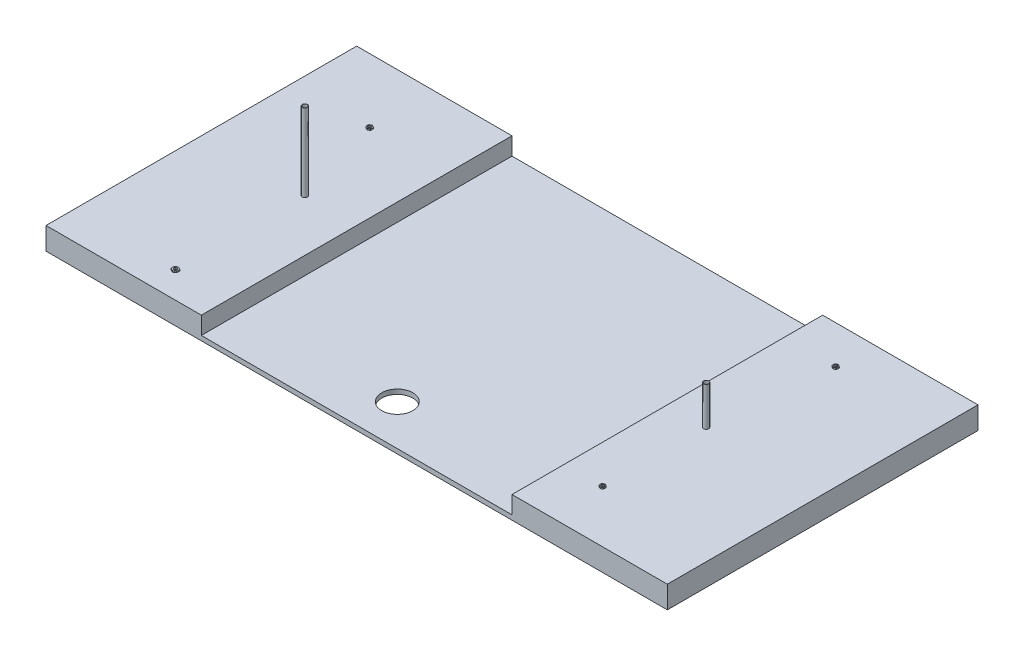
from build123d import *

# Parameters (mm, degrees)
SKETCH1_W           = 2400
SKETCH1_H           = 1200
SKETCH1_R           = 60
BOSS_EXTRUDE1_DEPTH = 18
BOSS_EXTRUDE2_START = 18
SKETCH2_W           = 600
SKETCH2_H           = 1200
BOSS_EXTRUDE2_DEPTH = 68
SKETCH3_R           = 10
SKETCH3_R_2         = 9
BOSS_EXTRUDE3_DEPTH = 300
SKETCH4_R           = 10
SKETCH4_R_2         = 9
BOSS_EXTRUDE4_DEPTH = 150
SKETCH6_R           = 6
BOSS_EXTRUDE5_DEPTH = 5
SKETCH7_R           = 6
BOSS_EXTRUDE6_DEPTH = 5


with BuildPart() as part:
    # Sketch1 → Boss-Extrude1 (new body)
    with BuildSketch(Plane(origin=(0, 0, 0), x_dir=(1, 0, 0), z_dir=(0, 1, 0))):
        Rectangle(SKETCH1_W, SKETCH1_H)
        with Locations(Location((0, -443.053648657, 0), (0, 0, 270))):
            Circle(SKETCH1_R, mode=Mode.SUBTRACT)
    extrude(amount=BOSS_EXTRUDE1_DEPTH)

    # Sketch2 → Boss-Extrude2 (add)
    with BuildSketch(Plane(origin=(0, 0, 0), x_dir=(1, 0, 0), z_dir=(0, 1, 0)).offset(BOSS_EXTRUDE2_START)):
        with Locations((-900, 0)):
            Rectangle(SKETCH2_W, SKETCH2_H)
        with Locations((900, 0)):
            Rectangle(SKETCH2_W, SKETCH2_H)
    extrude(amount=BOSS_EXTRUDE2_DEPTH)

    # Sketch3 → Boss-Extrude3 (add)
    with BuildSketch(Plane(origin=(0, 86, 0), x_dir=(1, 0, 0), z_dir=(0, 1, 0))):
        with Locations(Location((-800, 0, 0), (0, 0, 270))):
            Circle(SKETCH3_R)
        with Locations(Location((-800, 0, 0), (0, 0, 270))):
            Circle(SKETCH3_R_2, mode=Mode.SUBTRACT)
    extrude(amount=BOSS_EXTRUDE3_DEPTH)

    # Sketch4 → Boss-Extrude4 (add)
    with BuildSketch(Plane(origin=(0, 86, 0), x_dir=(1, 0, 0), z_dir=(0, 1, 0))):
        with Locations(Location((750, 0, 0), (0, 0, 270))):
            Circle(SKETCH4_R)
        with Locations(Location((750, 0, 0), (0, 0, 270))):
            Circle(SKETCH4_R_2, mode=Mode.SUBTRACT)
    extrude(amount=BOSS_EXTRUDE4_DEPTH)

    # Sketch6 → Boss-Extrude5 (add)
    # profile 1 of 2: a face of its own
    with BuildSketch(Plane(origin=(0, 86, 0), x_dir=(1, 0, 0), z_dir=(0, 1, 0))):
        Polygon((-800, -512.227333668), (-789.410818423, -506.113666834), (-789.410818423, -493.886333166), (-800, -487.772666332), (-810.589181577, -493.886333166), (-810.589181577, -506.113666834), align=None)
        with Locations(Location((-800, -500, 0), (0, 0, 270))):
            Circle(SKETCH6_R, mode=Mode.SUBTRACT)
    # profile 2 of 2: a face of its own
    with BuildSketch(Plane(origin=(0, 86, 0), x_dir=(1, 0, 0), z_dir=(0, 1, 0))):
        Polygon((-900, 360.617779526), (-909.195266801, 355.308889763), (-909.195266801, 344.691110237), (-900, 339.382220474), (-890.804733199, 344.691110237), (-890.804733199, 355.308889763), align=None)
        with Locations(Location((-900, 350, 0), (0, 0, 270))):
            Circle(SKETCH6_R, mode=Mode.SUBTRACT)
    extrude(amount=BOSS_EXTRUDE5_DEPTH)

    # Sketch7 → Boss-Extrude6 (add)
    # profile 1 of 2: a face of its own
    with BuildSketch(Plane(origin=(0, 86, 0), x_dir=(1, 0, 0), z_dir=(0, 1, 0))):
        Polygon((750, -410.254981665), (758.881074637, -405.127490833), (758.881074637, -394.872509167), (750, -389.745018335), (741.118925363, -394.872509167), (741.118925363, -405.127490833), align=None)
        with Locations(Location((750, -400, 0), (0, 0, 270))):
            Circle(SKETCH7_R, mode=Mode.SUBTRACT)
    # profile 2 of 2: a face of its own
    with BuildSketch(Plane(origin=(0, 86, 0), x_dir=(1, 0, 0), z_dir=(0, 1, 0))):
        Polygon((800, 460.50831519), (790.899532094, 455.254157595), (790.899532094, 444.745842405), (800, 439.49168481), (809.100467906, 444.745842405), (809.100467906, 455.254157595), align=None)
        with Locations(Location((800, 450, 0), (0, 0, 270))):
            Circle(SKETCH7_R, mode=Mode.SUBTRACT)
    extrude(amount=BOSS_EXTRUDE6_DEPTH)


solid = part.part
